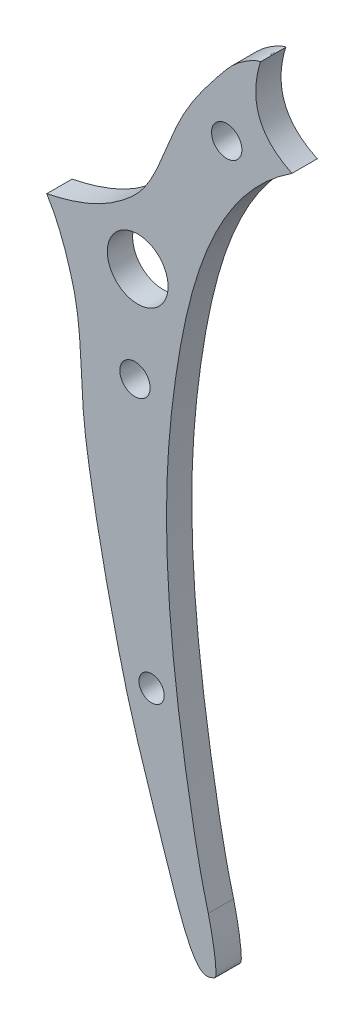
from build123d import *

# Parameters (mm, degrees)
SKETCH1_R           = 15
SKETCH1_R_2         = 12.5
SKETCH1_R_3         = 30
BOSS_EXTRUDE1_DEPTH = 25


with BuildPart() as part:
    # Sketch1 → Boss-Extrude1 (new body)
    with BuildSketch(Plane.XY):
        with BuildLine():
            add(Edge.make_bspline(
                [(155.117180068, 253.566910875), (80.961288669, 205.050155561), (44.445875871, 80.117169691), (23.740189073, -128.723756166), (44.701158868, -287.641647918), (65.309701333, -394.102371299), (72.449772872, -420.811527797)],
                knots=[0, 0, 0, 0, 0.356858306, 0.509383165, 0.894986659, 1, 1, 1, 1], degree=3))
            add(Edge.make_bspline(
                [(-87.186184352, 115.027901144), (-76.542527264, 98.281689617), (-67.48787126, 73.400437605), (-52.088989723, 17.03972506), (-54.219354673, -35.992317725), (-41.417131006, -126.676087435), (-11.075617496, -267.50878217), (3.320029035, -312.576186435), (60.024873998, -482.338487704), (72.157160931, -475.401329808), (81.909755072, -471.892242374), (77.479208572, -441.488096788), (72.449772872, -420.811527797)],
                knots=[0, 0, 0, 0, 0.079930548, 0.106477313, 0.247802054, 0.285951548, 0.470306661, 0.74315328, 0.791096182, 0.932109075, 0.954762118, 1, 1, 1, 1], degree=3))
            add(Edge.make_bspline(
                [(123.991455878, 333.411826796), (121.940962733, 333.924631612), (103.126737259, 325.59445724), (76.843409942, 293.735407357), (36.561568956, 242.824472463), (21.370441055, 176.135728769), (-25.797245054, 134.360058233), (-52.784107845, 122.398568009), (-87.186184352, 115.027901144)],
                knots=[0, 0, 0, 0, 0.175010549, 0.215542487, 0.405319386, 0.676608921, 0.736076982, 1, 1, 1, 1], degree=3))
            add(Edge.make_bspline(
                [(155.117180068, 253.566910875), (106.393272385, 276.590125095), (123.991455878, 333.411826796)],
                knots=[0, 0, 0, 1, 1, 1], degree=2))
        make_face()
        with Locations((90.635337981, 249.018544508)):
            Circle(SKETCH1_R, mode=Mode.SUBTRACT)
        Circle(SKETCH1_R, mode=Mode.SUBTRACT)
        with Locations((16.428699859, -256.271030274)):
            Circle(SKETCH1_R_2, mode=Mode.SUBTRACT)
        with Locations((2.708390911, 95.520355695)):
            Circle(SKETCH1_R_3, mode=Mode.SUBTRACT)
    extrude(amount=BOSS_EXTRUDE1_DEPTH)


solid = part.part
